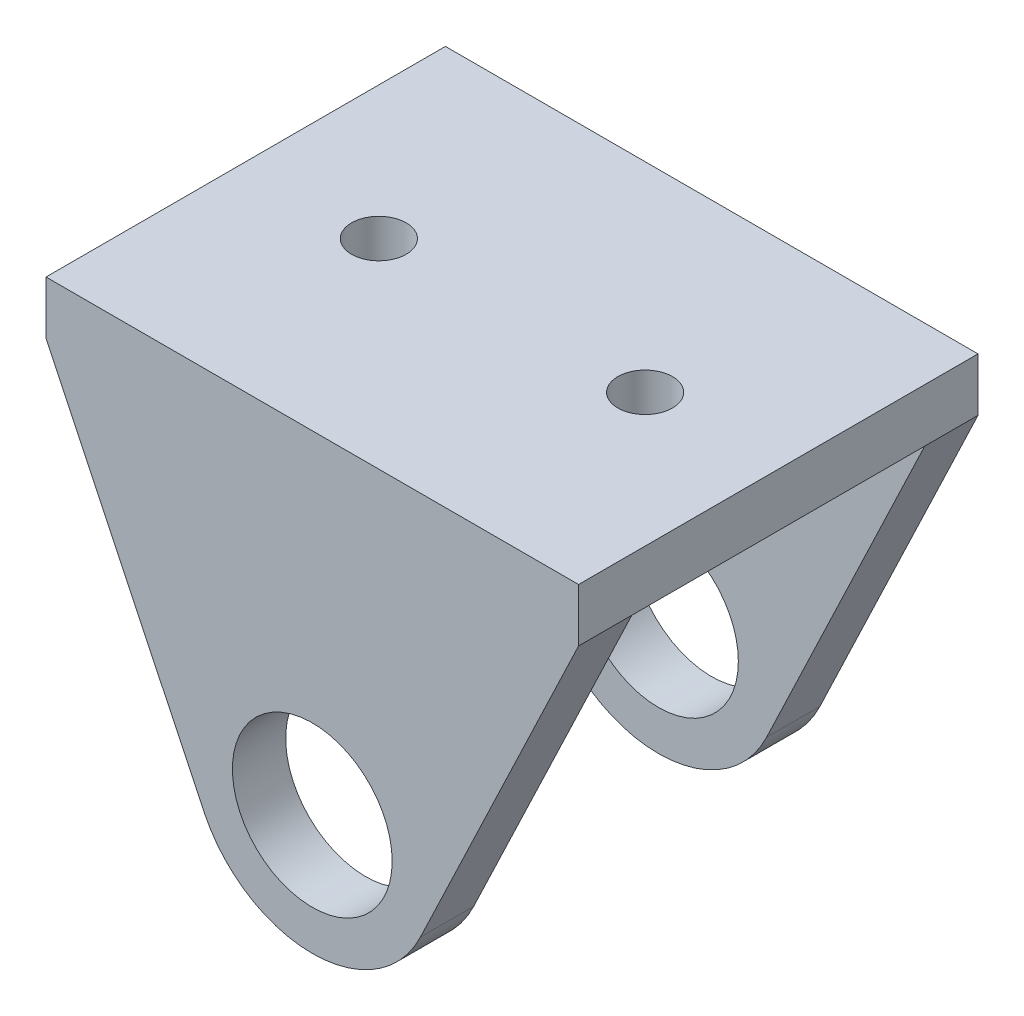
from build123d import *

# Parameters (mm, degrees)
SKETCH_1_W          = 40
SKETCH_1_H          = 20
EXTRUDE_1_DEPTH     = 4
SKETCH_2_R          = 6
EXTRUDE_2_DEPTH     = 5
SKETCH_3_W          = 40
SKETCH_3_H          = 35
CUT_EXTRUDE_1_DEPTH = 1
SKETCH_6_R          = 2.05
CUT_EXTRUDE_3_DEPTH = 10


with BuildPart() as part:
    # 草图1 → 凸台-拉伸1 (new body)
    with BuildSketch(Plane(origin=(0, 0, 0), x_dir=(1, 0, 0), z_dir=(0, 1, 0))):
        Rectangle(SKETCH_1_W, SKETCH_1_H)
    extrude(amount=-EXTRUDE_1_DEPTH)

    # 草图2 → 凸台-拉伸2 (add)
    with BuildSketch(Plane.XY.offset(10)):
        with BuildLine():
            Line((20, -4), (20, 0))
            Line((20, 0), (-20, 0))
            Line((-20, 0), (-20, -4))
            Line((-20, -4), (-8.121724647, -28.877832997))
            ThreePointArc((-8.121724647, -28.877832997), (0, -34), (8.121724647, -28.877832997))
            Line((8.121724647, -28.877832997), (20, -4))
        make_face()
        with Locations((0, -25)):
            Circle(SKETCH_2_R, mode=Mode.SUBTRACT)
    extrude_2 = extrude(amount=EXTRUDE_2_DEPTH)

    # 草图3 → 切除-拉伸1 (cut)
    with BuildSketch(Plane(origin=(0, 0, 10), x_dir=(-1, 0, 0), z_dir=(0, 0, -1))):
        with Locations((0, -21.5)):
            Rectangle(SKETCH_3_W, SKETCH_3_H)
    cut_extrude_1 = extrude(amount=-CUT_EXTRUDE_1_DEPTH, mode=Mode.SUBTRACT)

    # 镜向1: 凸台-拉伸2, 切除-拉伸1 across plane
    add(extrude_2.mirror(Plane.XY))
    add(cut_extrude_1.mirror(Plane.XY), mode=Mode.SUBTRACT)

    # 草图6 → 切除-拉伸3 (cut)
    with BuildSketch(Plane.XZ.offset(4)):
        with Locations(Location((-10, 0, 0), (0, 0, 270))):
            Circle(SKETCH_6_R)
        with Locations(Location((10, 0, 0), (0, 0, 270))):
            Circle(SKETCH_6_R)
    extrude(amount=-CUT_EXTRUDE_3_DEPTH, mode=Mode.SUBTRACT)


solid = part.part
